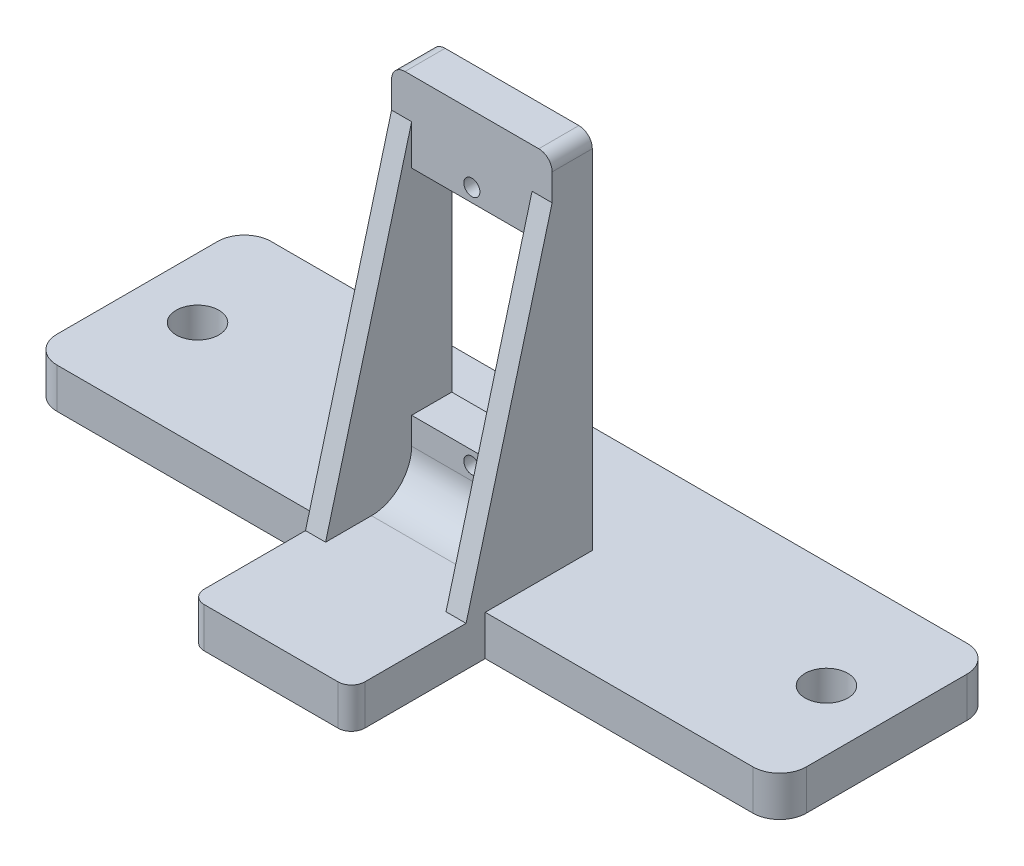
from build123d import *

# Parameters (mm, degrees)
SKETCH_1_W          = 56
SKETCH_1_H          = 16
EXTRUDE_1_DEPTH     = 3
SKETCH_3_R          = 1.6
CUT_EXTRUDE_2_DEPTH = 5
FILLET_1_R          = 2
EXTRUDE_2_DEPTH     = 3
SKETCH_5_R          = 0.6
SKETCH_5_W          = 9
SKETCH_5_H          = 16
EXTRUDE_3_DEPTH     = 3
EXTRUDE_5_DEPTH     = 1.5
EXTRUDE_6_DEPTH     = 1.5
EXTRUDE_7_DEPTH     = 9


with BuildPart() as part:
    # 草图1 → 凸台-拉伸1 (new body)
    with BuildSketch(Plane(origin=(0, 0, 0), x_dir=(1, 0, 0), z_dir=(0, 1, 0))):
        Rectangle(SKETCH_1_W, SKETCH_1_H)
    extrude(amount=EXTRUDE_1_DEPTH)

    # 草图3 → 切除-拉伸2 (cut)
    with BuildSketch(Plane(origin=(0, 3, 0), x_dir=(1, 0, 0), z_dir=(0, 1, 0))):
        with Locations(Location((23.5, 0, 0), (0, 0, 270))):
            Circle(SKETCH_3_R)
        with Locations(Location((-23.5, 0, 0), (0, 0, 270))):
            Circle(SKETCH_3_R)
    extrude(amount=-CUT_EXTRUDE_2_DEPTH, mode=Mode.SUBTRACT)

    # 圆角1
    fillet_1_edges = [part.edges().sort_by_distance(p)[0] for p in [
        (28, 1.5, 8),
        (-28, 1.5, 8),
        (-28, 1.5, -8),
        (28, 1.5, -8),
    ]]
    fillet(fillet_1_edges, radius=FILLET_1_R)

    # 草图4 → 凸台-拉伸2 (add)
    with BuildSketch(Plane(origin=(0, 3, 0), x_dir=(1, 0, 0), z_dir=(0, 1, 0))):
        with BuildLine():
            Line((0, -8), (0, -18))
            Line((0, -18), (5, -18))
            ThreePointArc((5, -18), (5.707106781, -17.707106781), (6, -17))
            Line((6, -17), (6, -8))
            Line((6, -8), (0, -8))
        make_face()
        with BuildLine():
            Line((-5, -18), (0, -18))
            Line((0, -18), (0, -8))
            Line((0, -8), (-6, -8))
            Line((-6, -8), (-6, -17))
            ThreePointArc((-6, -17), (-5.707106781, -17.707106781), (-5, -18))
        make_face()
    extrude(amount=-EXTRUDE_2_DEPTH)

    # 草图5 → 凸台-拉伸3 (add)
    with BuildSketch(Plane.XY):
        with BuildLine():
            Line((-6, 3), (-6, 29))
            ThreePointArc((-6, 29), (-5.707106781, 29.707106781), (-5, 30))
            Line((-5, 30), (5, 30))
            ThreePointArc((5, 30), (5.707106781, 29.707106781), (6, 29))
            Line((6, 29), (6, 3))
            Line((6, 3), (-6, 3))
        make_face()
        with Locations((0, 7)):
            Circle(SKETCH_5_R, mode=Mode.SUBTRACT)
        with Locations(Location((0, 25, 0), (0, 0, 180))):
            Circle(SKETCH_5_R, mode=Mode.SUBTRACT)
        with Locations((0, 16)):
            Rectangle(SKETCH_5_W, SKETCH_5_H, mode=Mode.SUBTRACT)
    extrude(amount=EXTRUDE_3_DEPTH)

    # 草图7 → 凸台-拉伸5 (add)
    with BuildSketch(Plane(origin=(6, 0, 0), x_dir=(0, 0, -1), z_dir=(1, 0, 0))):
        Polygon((-3, 27), (-9.430780618, 3), (-3, 3), align=None)
    extrude(amount=-EXTRUDE_5_DEPTH)

    # 草图8 → 凸台-拉伸6 (add)
    with BuildSketch(Plane.ZY.offset(6)):
        Polygon((3, 27), (9.430780618, 3), (3, 3), align=None)
    extrude(amount=-EXTRUDE_6_DEPTH)

    # 草图9 → 凸台-拉伸7 (add)
    with BuildSketch(Plane.ZY.offset(-4.5)):
        with BuildLine():
            Line((3, 6), (3, 3))
            Line((3, 3), (6, 3))
            ThreePointArc((6, 3), (3.878679656, 3.878679656), (3, 6))
        make_face()
    extrude(amount=EXTRUDE_7_DEPTH)


solid = part.part
